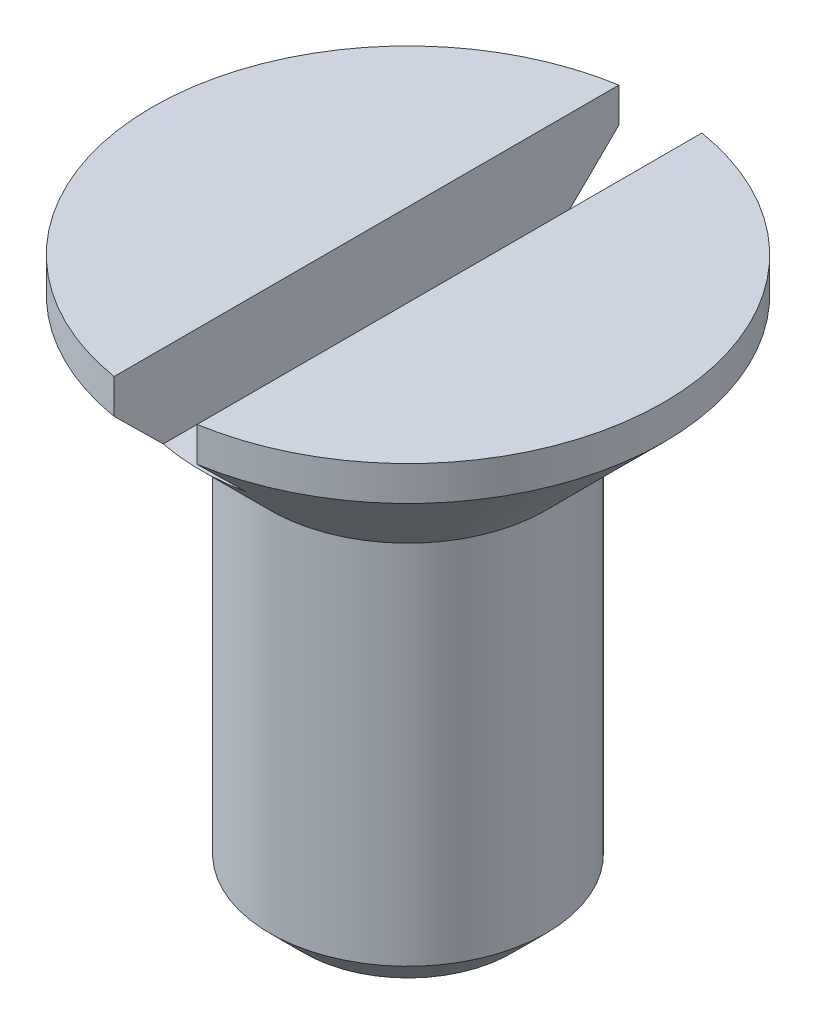
from build123d import *

# Parameters (mm, degrees)
CUT_EXTRUDE_1_DEPTH      = 10.559288676
CUT_EXTRUDE_1_DEPTH_BACK = 10.559288676
SKETCH_2_W               = 1.2
SKETCH_2_H               = 1.2


with BuildPart() as part:
    # Эскиз1 → Повернуть1 (revolve)
    with BuildSketch(Plane.XY):
        Polygon((0, 0), (-1.5, 0), (-2, 0.5), (-2, 5.8), (-3.7, 7.5), (-3.7, 8), (0, 8), align=None)
    revolve(axis=Axis((0, 8, 0), (0, -1, 0)))

    # Эскиз2 → Вырез-Вытянуть1 (cut, two sides: drawn at the far end of the back side and taken through both)
    with BuildSketch(Plane.XY.offset(-CUT_EXTRUDE_1_DEPTH_BACK)):
        with Locations((0, 7.4)):
            Rectangle(SKETCH_2_W, SKETCH_2_H)
    extrude(amount=CUT_EXTRUDE_1_DEPTH + CUT_EXTRUDE_1_DEPTH_BACK, mode=Mode.SUBTRACT)


solid = part.part
